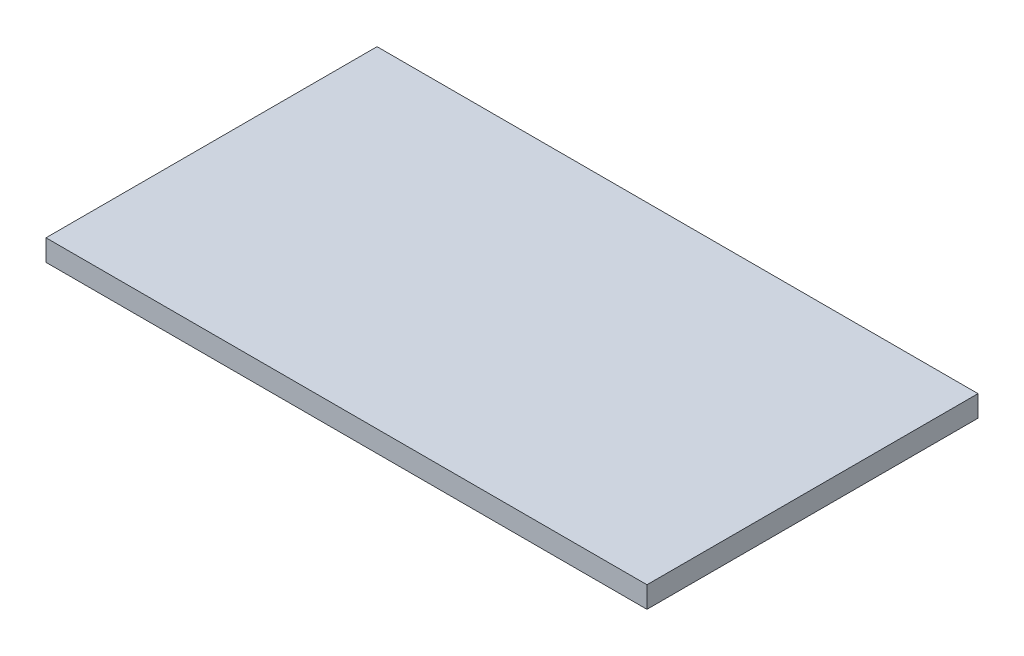
from build123d import *

# Parameters (mm, degrees)
SKETCH1_W           = 42.3
SKETCH1_H           = 23.3
BOSS_EXTRUDE1_DEPTH = 1.5


with BuildPart() as part:
    # Sketch1 → Boss-Extrude1 (new body)
    with BuildSketch(Plane(origin=(0, 0, 0), x_dir=(1, 0, 0), z_dir=(0, 1, 0))):
        with Locations((21.15, -11.65)):
            Rectangle(SKETCH1_W, SKETCH1_H)
    extrude(amount=BOSS_EXTRUDE1_DEPTH)


solid = part.part
